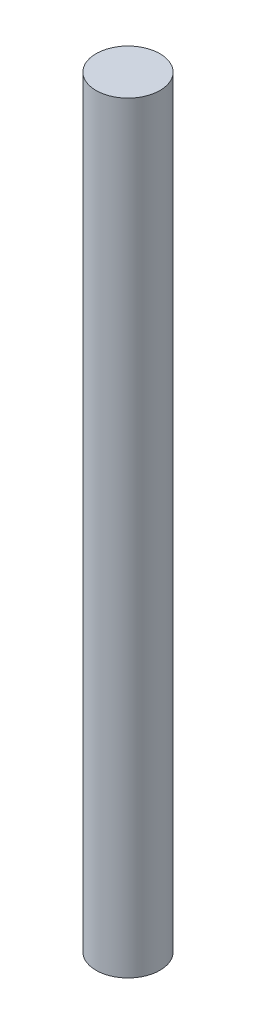
from build123d import *

# Parameters (mm, degrees)
SKETCH1_R           = 1.905
BOSS_EXTRUDE1_DEPTH = 45.466


with BuildPart() as part:
    # Sketch1 → Boss-Extrude1 (new body)
    with BuildSketch(Plane(origin=(0, 0, 0), x_dir=(1, 0, 0), z_dir=(0, 1, 0))):
        with Locations(Location((0, 0, 0), (0, 0, 270))):
            Circle(SKETCH1_R)
    extrude(amount=BOSS_EXTRUDE1_DEPTH)


solid = part.part
